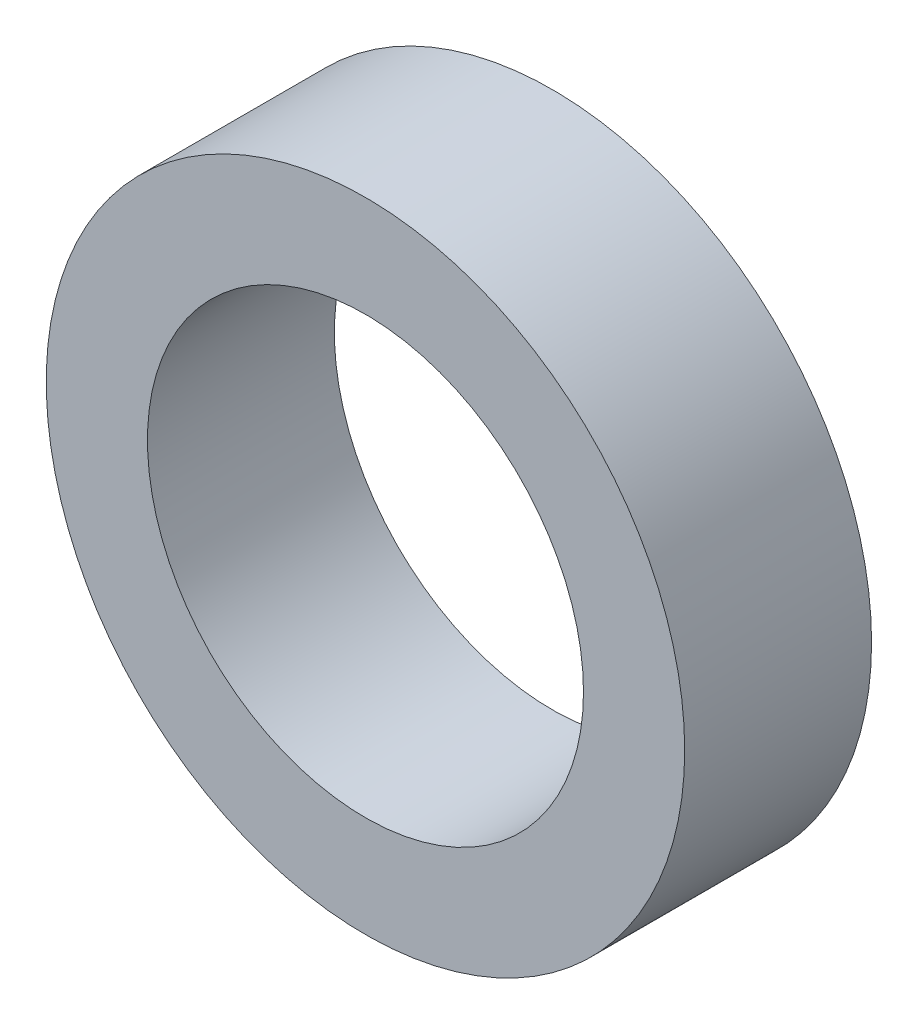
from build123d import *

# Parameters (mm, degrees)
SKETCH1_R           = 20.5
SKETCH1_R_2         = 14
BOSS_EXTRUDE1_DEPTH = 12


with BuildPart() as part:
    # Sketch1 → Boss-Extrude1 (new body)
    with BuildSketch(Plane.XY):
        Circle(SKETCH1_R)
        Circle(SKETCH1_R_2, mode=Mode.SUBTRACT)
    extrude(amount=-BOSS_EXTRUDE1_DEPTH)


solid = part.part
